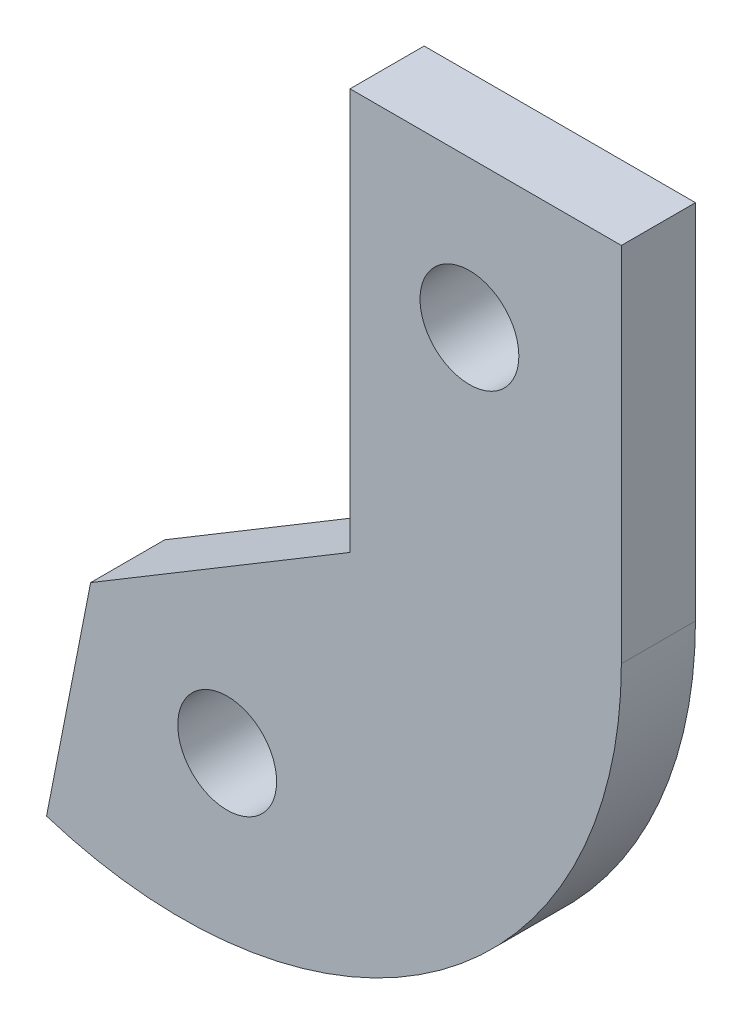
from build123d import *

# Parameters (mm, degrees)
SKETCH2_R           = 2
BOSS_EXTRUDE1_DEPTH = 3


with BuildPart() as part:
    # Sketch2 → Boss-Extrude1 (new body)
    with BuildSketch(Plane(origin=(0, 0, 0), x_dir=(-1, 0, 0), z_dir=(0, 0, 1))):
        with BuildLine():
            Line((-9.017950721, -7.332311194), (-20, -7.332311194))
            Line((-20, -7.332311194), (-20, 7.332311194))
            ThreePointArc((-20, 7.332311194), (-12.680293068, 21.732536084), (3.26719031, 24.305930805))
            Line((3.26719031, 24.305930805), (1.482539955, 15.227759845))
            Line((1.482539955, 15.227759845), (-9.017950721, 8.920221357))
            Line((-9.017950721, 8.920221357), (-9.017950721, -7.332311194))
        make_face()
        with Locations(Location((-13.851036571, -1.379219301, 0), (0, 0, 180))):
            Circle(SKETCH2_R, mode=Mode.SUBTRACT)
        with Locations(Location((-4.045326452, 18.443425538, 0), (0, 0, 180))):
            Circle(SKETCH2_R, mode=Mode.SUBTRACT)
    extrude(amount=BOSS_EXTRUDE1_DEPTH)


solid = part.part
